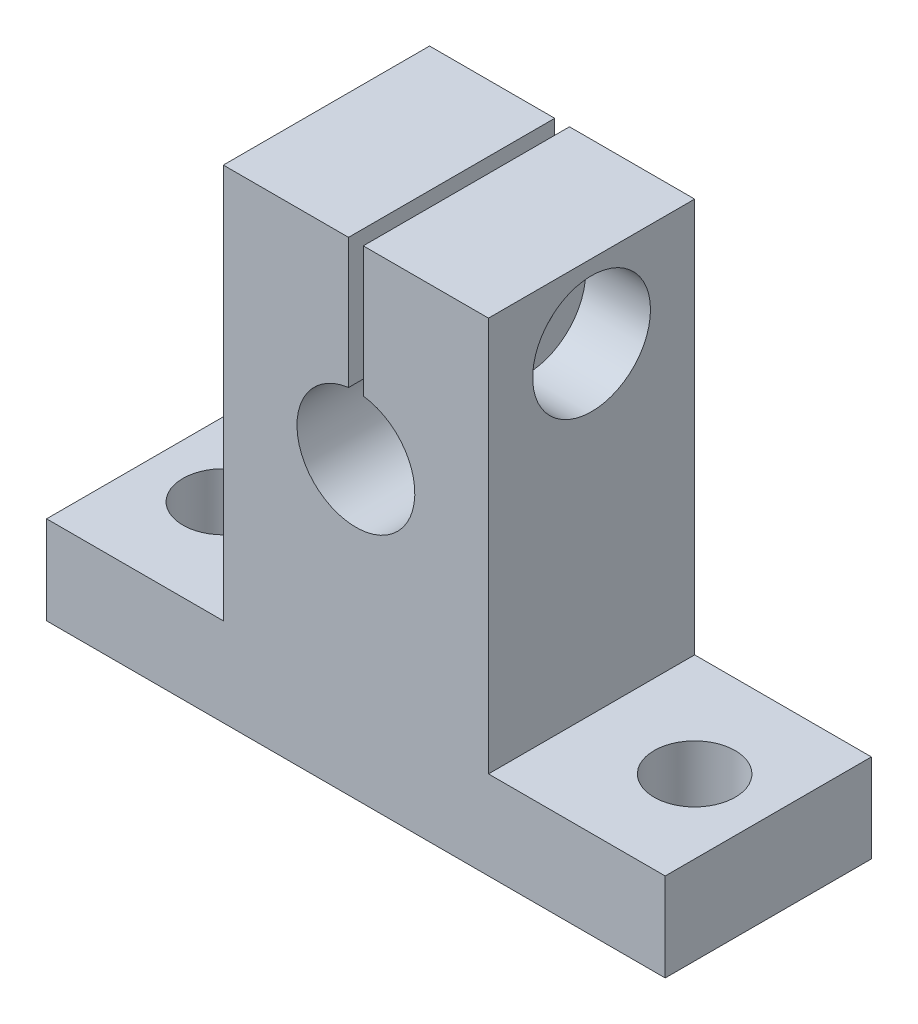
from build123d import *

# Parameters (mm, degrees)
SALIENTE_EXTRUIR1_DEPTH                              = 7
SALIENTE_EXTRUIR1_DEPTH_BACK                         = 7
CROQUIS1_R                                           = 4
TALADRO_DE_MARGEN_PARA_M51_D                         = 5.5
CORTAR_EXTRUIR1_DEPTH                                = 40.570696228
CORTAR_EXTRUIR1_DEPTH_BACK                           = 40.570696228
CROQUIS6_W                                           = 1
CROQUIS6_H                                           = 17.84861806
REFRENTADO_PARA_TORNILLO_CON_CABEZA_HUEC_D           = 4.5
REFRENTADO_PARA_TORNILLO_CON_CABEZA_HUEC_CBORE_D     = 8
REFRENTADO_PARA_TORNILLO_CON_CABEZA_HUEC_CBORE_DEPTH = 4.4


with BuildPart() as part:
    # Croquis1 → Saliente-Extruir1 (new, two sides: drawn at the far end of the back side and taken through both)
    with BuildSketch(Plane.XY.offset(-SALIENTE_EXTRUIR1_DEPTH_BACK)):
        Polygon((-21, 0), (21, 0), (21, 6), (9, 6), (9, 32.8), (-9, 32.8), (-9, 6), (-21, 6), align=None)
        with Locations((0, 20)):
            Circle(CROQUIS1_R, mode=Mode.SUBTRACT)
    extrude(amount=SALIENTE_EXTRUIR1_DEPTH + SALIENTE_EXTRUIR1_DEPTH_BACK)

    # Taladro de margen para M51 (through all)
    with Locations(Plane(origin=(0, 0, 0), x_dir=(-1, 0, 0), z_dir=(0, -1, 0))):
        with Locations((-16, 0), (16, 0)):
            Hole(TALADRO_DE_MARGEN_PARA_M51_D / 2)

    # Croquis6 → Cortar-Extruir1 (cut, two sides: drawn at the far end of the back side and taken through both)
    with BuildSketch(Plane.XY.offset(-CORTAR_EXTRUIR1_DEPTH_BACK)):
        with Locations((0, 28.92430903)):
            Rectangle(CROQUIS6_W, CROQUIS6_H)
    extrude(amount=CORTAR_EXTRUIR1_DEPTH + CORTAR_EXTRUIR1_DEPTH_BACK, mode=Mode.SUBTRACT)

    # Refrentado para tornillo con cabeza hueca de M41 (through all)
    with Locations(Plane(origin=(9, 0, 0), x_dir=(0, 0, -1), z_dir=(1, 0, 0))):
        with Locations((0, 27.8)):
            CounterBoreHole(REFRENTADO_PARA_TORNILLO_CON_CABEZA_HUEC_D / 2, REFRENTADO_PARA_TORNILLO_CON_CABEZA_HUEC_CBORE_D / 2, REFRENTADO_PARA_TORNILLO_CON_CABEZA_HUEC_CBORE_DEPTH)


solid = part.part
